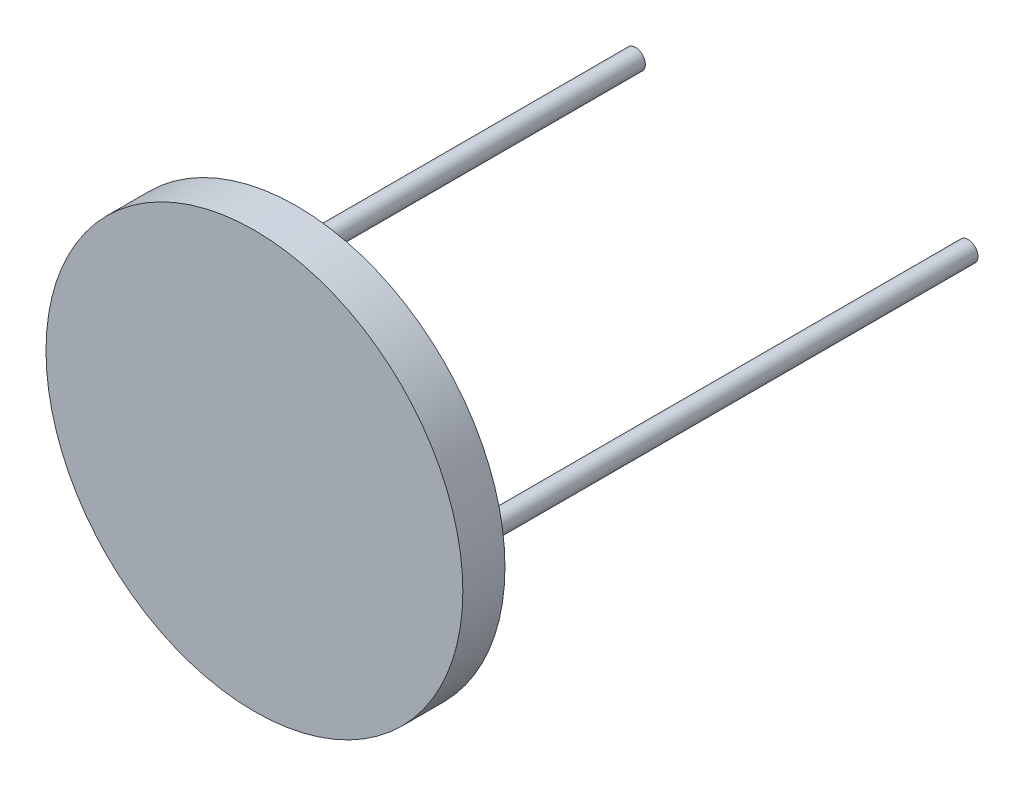
from build123d import *

# Parameters (mm, degrees)
SKETCH1_R           = 9.9
BOSS_EXTRUDE1_DEPTH = 2
SKETCH2_R           = 0.47
BOSS_EXTRUDE2_DEPTH = 24


with BuildPart() as part:
    # Sketch1 → Boss-Extrude1 (new body)
    with BuildSketch(Plane.XY):
        Circle(SKETCH1_R)
    extrude(amount=BOSS_EXTRUDE1_DEPTH)

    # Sketch2 → Boss-Extrude2 (add)
    with BuildSketch(Plane(origin=(0, 0, 0), x_dir=(-1, 0, 0), z_dir=(0, 0, -1))):
        with Locations(Location((-7.9, 0, 0), (0, 0, 180))):
            Circle(SKETCH2_R)
        with Locations(Location((7.9, 0, 0), (0, 0, 180))):
            Circle(SKETCH2_R)
    extrude(amount=BOSS_EXTRUDE2_DEPTH)


solid = part.part
